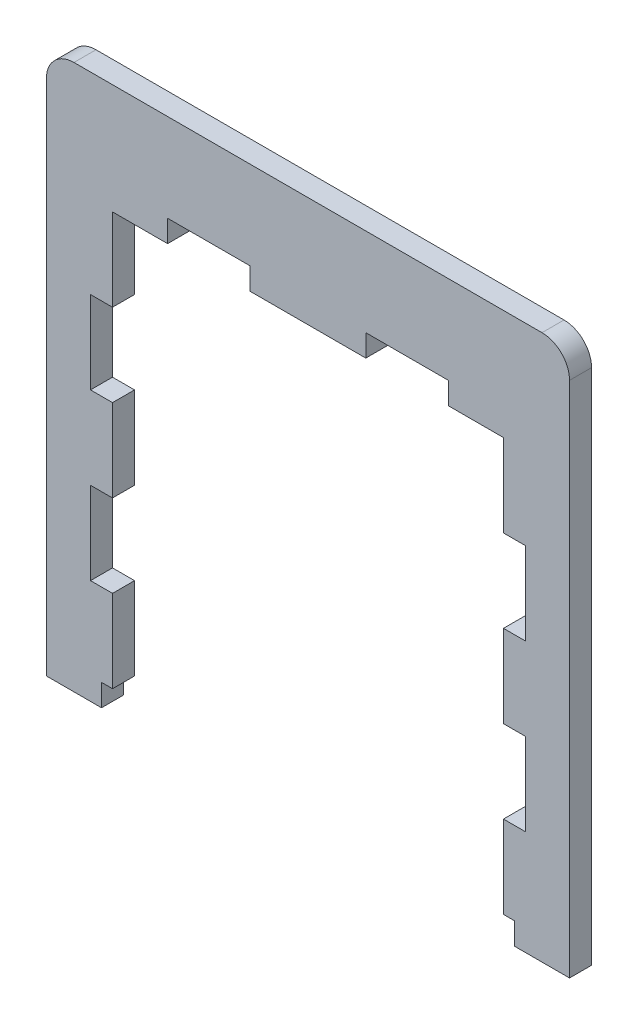
from build123d import *

# Parameters (mm, degrees)
BOSS_EXTRUDE1_DEPTH = 2
SKETCH2_W           = 10
SKETCH2_H           = 4
BOSS_EXTRUDE2_DEPTH = 4
FILLET1_R           = 5


with BuildPart() as part:
    # Sketch1 → Boss-Extrude1 (new, symmetric)
    with BuildSketch(Plane.XY):
        Polygon((-47.5, -47.5), (-35.5, -47.5), (-35.5, -32.5), (-39.5, -32.5), (-39.5, -17.5), (-35.5, -17.5), (-35.5, -2.5), (-39.5, -2.5), (-39.5, 12.5), (-35.5, 12.5), (-35.5, 27.5), (-25.5, 27.5), (-25.5, 31.5), (-10.5, 31.5), (-10.5, 27.5), (10.5, 27.5), (10.5, 31.5), (25.5, 31.5), (25.5, 27.5), (35.5, 27.5), (35.5, 12.5), (39.5, 12.5), (39.5, -2.5), (35.5, -2.5), (35.5, -17.5), (39.5, -17.5), (39.5, -32.5), (35.5, -32.5), (35.5, -47.5), (47.5, -47.5), (47.5, 47.5), (-47.5, 47.5), align=None)
    extrude(amount=BOSS_EXTRUDE1_DEPTH, both=True)

    # Sketch2 → Boss-Extrude2 (add)
    with BuildSketch(Plane.XZ.offset(47.5)):
        with Locations((-42.5, 0)):
            Rectangle(SKETCH2_W, SKETCH2_H)
        with Locations((42.5, 0)):
            Rectangle(SKETCH2_W, SKETCH2_H)
    extrude(amount=BOSS_EXTRUDE2_DEPTH)

    # Fillet1
    fillet1_edges = [part.edges().sort_by_distance(p)[0] for p in [
        (47.5, 47.5, 0),
        (-47.5, 47.5, 0),
    ]]
    fillet(fillet1_edges, radius=FILLET1_R)


solid = part.part
